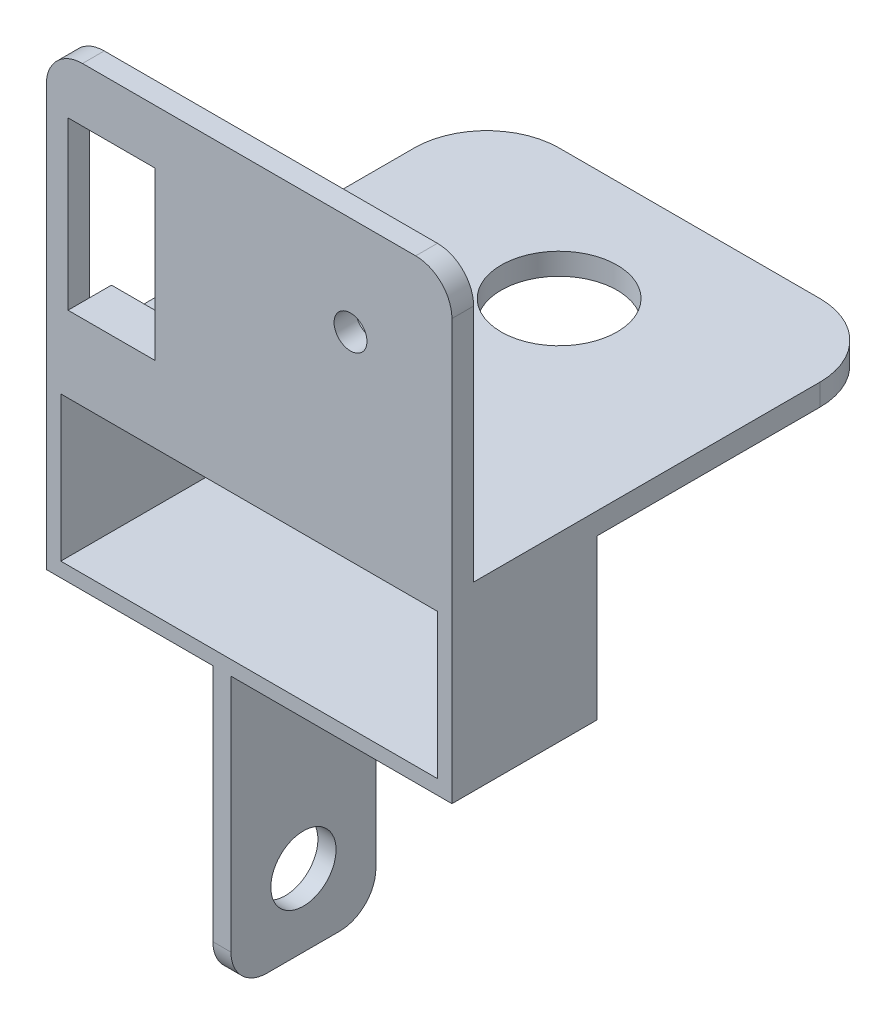
from build123d import *

# Parameters (mm, degrees)
SKETCH1_W                = 50
SKETCH1_H                = 57.8
BOSS_EXTRUDE1_DEPTH      = 3
SKETCH1_3_W              = 50
SKETCH1_3_H              = 3
BOSS_EXTRUDE2_DEPTH      = 63
SKETCH7_W                = 10
SKETCH7_H                = 20
BOSS_EXTRUDE6_DEPTH      = 60
SKETCH8_W                = 7.5
SKETCH8_H                = 20
CUT_EXTRUDE4_DEPTH       = 60
SKETCH10_R               = 4.5
CUT_EXTRUDE5_DEPTH       = 60
FILLET1_R                = 5
FILLET2_R                = 5
CUT_EXTRUDE6_REACH       = 93.771
FILLET4_R                = 5
BOSS_EXTRUDE7_DEPTH      = 3
BOSS_EXTRUDE8_DEPTH      = 3
SKETCH15_R               = 8
CUT_EXTRUDE7_DEPTH       = 3
CUT_EXTRUDE8_DEPTH       = 40
BOSS_EXTRUDE9_DEPTH      = 23
BOSS_EXTRUDE9_DEPTH_BACK = 33
SKETCH17_W               = 20
SKETCH17_H               = 2
BOSS_EXTRUDE25_REACH     = 95.87
SKETCH19_W               = 56
SKETCH19_H               = 20
CUT_EXTRUDE9_REACH       = 83.018
CUT_EXTRUDE10_REACH      = 78.756
SKETCH27_R               = 8
SKETCH28_W               = 12
SKETCH28_H               = 4.5
BOSS_EXTRUDE26_DEPTH     = 3
SKETCH28_3_W             = 12
SKETCH28_3_H             = 23
CUT_EXTRUDE11_DEPTH      = 3
SKETCH29_W               = 56
SKETCH29_H               = 22
CUT_EXTRUDE12_DEPTH      = 3
FILLET5_R                = 5
FILLET6_R                = 10
CUT_EXTRUDE13_REACH      = 90.719
SKETCH30_R               = 2.271159968


with BuildPart() as part:
    # Sketch1 → Boss-Extrude1 (new body)
    with BuildSketch(Plane(origin=(0, 0, 0), x_dir=(1, 0, 0), z_dir=(0, 1, 0))):
        with Locations((2.5, 0.4)):
            Rectangle(SKETCH1_W, SKETCH1_H)
    extrude(amount=BOSS_EXTRUDE1_DEPTH)

    # Sketch1<3> → Boss-Extrude2 (add)
    with BuildSketch(Plane(origin=(0, 0, 0), x_dir=(1, 0, 0), z_dir=(0, 1, 0))):
        with Locations((2.5, -30)):
            Rectangle(SKETCH1_3_W, SKETCH1_3_H)
    extrude(amount=BOSS_EXTRUDE2_DEPTH)

    # Sketch7 → Boss-Extrude6 (add)
    with BuildSketch(Plane.XZ):
        with Locations((2.5, 21.5)):
            Rectangle(SKETCH7_W, SKETCH7_H)
    extrude(amount=BOSS_EXTRUDE6_DEPTH)

    # Sketch8 → Cut-Extrude4 (cut)
    with BuildSketch(Plane(origin=(0, 0, 11.5), x_dir=(-1, 0, 0), z_dir=(0, 0, -1))):
        with Locations((-3.75, -50)):
            Rectangle(SKETCH8_W, SKETCH8_H)
    extrude(amount=-CUT_EXTRUDE4_DEPTH, mode=Mode.SUBTRACT)

    # Sketch10 → Cut-Extrude5 (cut)
    with BuildSketch(Plane(origin=(0, 0, 0), x_dir=(0, 0, -1), z_dir=(1, 0, 0))):
        with Locations((-21.5, -50)):
            Circle(SKETCH10_R)
    extrude(amount=-CUT_EXTRUDE5_DEPTH, mode=Mode.SUBTRACT)

    # Fillet1
    fillet1_edges = [part.edges().sort_by_distance(p)[0] for p in [
        (7.5, -20, 11.5),
    ]]
    fillet(fillet1_edges, radius=FILLET1_R)

    # Fillet2
    fillet2_edges = [part.edges().sort_by_distance(p)[0] for p in [
        (7.5, -20, 31.5),
    ]]
    fillet(fillet2_edges, radius=FILLET2_R)

    # Sketch11 → Cut-Extrude6 (cut, up to next)
    with BuildSketch(Plane.XY.offset(31.5), mode=Mode.PRIVATE) as cut_extrude6_sk1:
        with BuildLine():
            Line((7.5, -40), (0, -40))
            Line((0, -40), (0, -20))
            ThreePointArc((0, -20), (2.621852946, -15.723111223), (7.5, -14.552824164))
            Line((7.5, -14.552824164), (7.5, -40))
        make_face()
    cut_extrude6_tool1 = extrude(cut_extrude6_sk1.sketch, amount=-CUT_EXTRUDE6_REACH, mode=Mode.PRIVATE) & part.part
    add(cut_extrude6_tool1.solids().sort_by_distance((3.859065, -27.782641, 31.5))[0], mode=Mode.SUBTRACT)

    # Fillet4
    fillet4_edges = [part.edges().sort_by_distance(p)[0] for p in [
        (-1.25, -60, 31.5),
        (-1.25, -60, 11.5),
    ]]
    fillet(fillet4_edges, radius=FILLET4_R)

    # Sketch13 → Boss-Extrude7 (add)
    with BuildSketch(Plane(origin=(27.5, 0, 0), x_dir=(0, 0, -1), z_dir=(1, 0, 0))):
        Polygon((-31.5, 0), (29.3, 0), (29.3, 3), (-28.5, 3), (-28.5, 63), (-31.5, 63), align=None)
    extrude(amount=BOSS_EXTRUDE7_DEPTH)

    # Sketch14 → Boss-Extrude8 (add)
    with BuildSketch(Plane.ZY.offset(22.5)):
        Polygon((-29.3, 0), (31.5, 0), (31.5, 63), (28.5, 63), (28.5, 3), (-29.3, 3), align=None)
    extrude(amount=BOSS_EXTRUDE8_DEPTH)

    # Sketch15 → Cut-Extrude7 (cut)
    with BuildSketch(Plane(origin=(0, 3, 0), x_dir=(1, 0, 0), z_dir=(0, 1, 0))):
        with Locations((2.5, 11.3)):
            Circle(SKETCH15_R)
        with Locations((2.5, -14.7)):
            Circle(SKETCH15_R)
    extrude(amount=-CUT_EXTRUDE7_DEPTH, mode=Mode.SUBTRACT)

    # Sketch16 → Cut-Extrude8 (cut, symmetric)
    with BuildSketch(Plane(origin=(0, 0, 0), x_dir=(0, 0, -1), z_dir=(1, 0, 0))):
        Polygon((-31.5, -20), (-11.5, -20), (-11.5, 0), (-31.5, 0.262000387), align=None)
    extrude(amount=CUT_EXTRUDE8_DEPTH, both=True, mode=Mode.SUBTRACT)


with BuildPart() as cut_extrude8_piece_1:
    # of the separate pieces the step leaves, piece 1, a body of its own (cut_extrude8_pieces)
    add(part.part.solids().sort_by_distance((30.5, 63, 31.5))[0])



with BuildPart() as cut_extrude8_piece_2:
    # of the separate pieces the step leaves, piece 2, a body of its own (cut_extrude8_pieces)
    add(part.part.solids().sort_by_distance((0, -55, 31.5))[0])

    # Sketch17 → Boss-Extrude9 (add, two sides: drawn at the far end of the back side and taken through both)
    with BuildSketch(Plane.ZY.offset(2.5).offset(-BOSS_EXTRUDE9_DEPTH_BACK)):
        with Locations((21.5, -21)):
            Rectangle(SKETCH17_W, SKETCH17_H)
    extrude(amount=BOSS_EXTRUDE9_DEPTH + BOSS_EXTRUDE9_DEPTH_BACK)


with BuildPart() as cut_extrude8_piece_1_1:
    add(cut_extrude8_piece_1.part)

    add(cut_extrude8_piece_2.part)  # Boss-Extrude25 merges Cut-Extrude8 piece 2
    # Boss-Extrude25: up to this plane
    boss_extrude25_end = Plane(origin=(-40, 0, 11.5), z_dir=(0, 0.9999142057885084, -0.013098895462462855))
    # Sketch19 → Boss-Extrude25 (add, up to the surface)
    with BuildSketch(Plane(origin=(0, -20, 0), x_dir=(1, 0, 0), z_dir=(0, 1, 0)), mode=Mode.PRIVATE) as boss_extrude25_sk1:
        with Locations((2.5, -21.5)):
            Rectangle(SKETCH19_W, SKETCH19_H)
    boss_extrude25_tool1 = split(extrude(boss_extrude25_sk1.sketch, amount=BOSS_EXTRUDE25_REACH, mode=Mode.PRIVATE), bisect_by=boss_extrude25_end, keep=Keep.BOTH, mode=Mode.PRIVATE)
    add(boss_extrude25_tool1.solids().sort_by_distance((2.5, -20, 21.5))[0])

    # Sketch25 → Cut-Extrude9 (cut, up to next)
    with BuildSketch(Plane(origin=(0, 0, 11.5), x_dir=(-1, 0, 0), z_dir=(0, 0, -1)), mode=Mode.PRIVATE) as cut_extrude9_sk1:
        Polygon((-9.832121112, 0), (-28.5, 0), (-28.5, -20), (23.5, -20), (23.5, 0), (4.832121112, 0), align=None)
    cut_extrude9_tool1 = extrude(cut_extrude9_sk1.sketch, amount=-CUT_EXTRUDE9_REACH, mode=Mode.PRIVATE) & cut_extrude8_piece_1_1.part
    add(cut_extrude9_tool1.solids().sort_by_distance((2.5, -10, 11.5))[0], mode=Mode.SUBTRACT)

    # Sketch27 → Cut-Extrude10 (cut, up to next)
    with BuildSketch(Plane.XZ, mode=Mode.PRIVATE) as cut_extrude10_sk1:
        with Locations((2.5, 14.7)):
            Circle(SKETCH27_R)
    cut_extrude10_tool1 = extrude(cut_extrude10_sk1.sketch, amount=-CUT_EXTRUDE10_REACH, mode=Mode.PRIVATE) & cut_extrude8_piece_1_1.part
    add(cut_extrude10_tool1.solids().sort_by_distance((2.5, 0, 14.7))[0], mode=Mode.SUBTRACT)

    # Sketch28 → Boss-Extrude26 (add)
    with BuildSketch(Plane(origin=(0, 0, 28.5), x_dir=(-1, 0, 0), z_dir=(0, 0, -1))):
        with Locations((16.5, 35.75)):
            Rectangle(SKETCH28_W, SKETCH28_H)
        with Locations((16.5, 8.25)):
            Rectangle(SKETCH28_W, SKETCH28_H)
    extrude(amount=BOSS_EXTRUDE26_DEPTH)

    # Sketch28<3> → Cut-Extrude11 (cut)
    with BuildSketch(Plane(origin=(0, 0, 28.5), x_dir=(-1, 0, 0), z_dir=(0, 0, -1))):
        with Locations((16.5, 22)):
            Rectangle(SKETCH28_3_W, SKETCH28_3_H)
    extrude(amount=-CUT_EXTRUDE11_DEPTH, mode=Mode.SUBTRACT)

    # Sketch29 → Cut-Extrude12 (cut)
    with BuildSketch(Plane(origin=(0, 0, 28.5), x_dir=(-1, 0, 0), z_dir=(0, 0, -1))):
        with Locations((-2.5, 52)):
            Rectangle(SKETCH29_W, SKETCH29_H)
    extrude(amount=-CUT_EXTRUDE12_DEPTH, mode=Mode.SUBTRACT)

    # Fillet5
    fillet5_edges = [cut_extrude8_piece_1_1.edges().sort_by_distance(p)[0] for p in [
        (30.5, 41, 30),
        (-25.5, 41, 30),
    ]]
    fillet(fillet5_edges, radius=FILLET5_R)

    # Fillet6
    fillet6_edges = [cut_extrude8_piece_1_1.edges().sort_by_distance(p)[0] for p in [
        (30.5, 1.5, -29.3),
        (-25.5, 1.5, -29.3),
    ]]
    fillet(fillet6_edges, radius=FILLET6_R)

    # Sketch30 → Cut-Extrude13 (cut, up to next)
    with BuildSketch(Plane(origin=(0, 0, 28.5), x_dir=(-1, 0, 0), z_dir=(0, 0, -1)), mode=Mode.PRIVATE) as cut_extrude13_sk1:
        with Locations((-16.5, 27.4)):
            Circle(SKETCH30_R)
    cut_extrude13_tool1 = extrude(cut_extrude13_sk1.sketch, amount=-CUT_EXTRUDE13_REACH, mode=Mode.PRIVATE) & cut_extrude8_piece_1_1.part
    add(cut_extrude13_tool1.solids().sort_by_distance((16.5, 27.4, 28.5))[0], mode=Mode.SUBTRACT)


solid = cut_extrude8_piece_1_1.part
